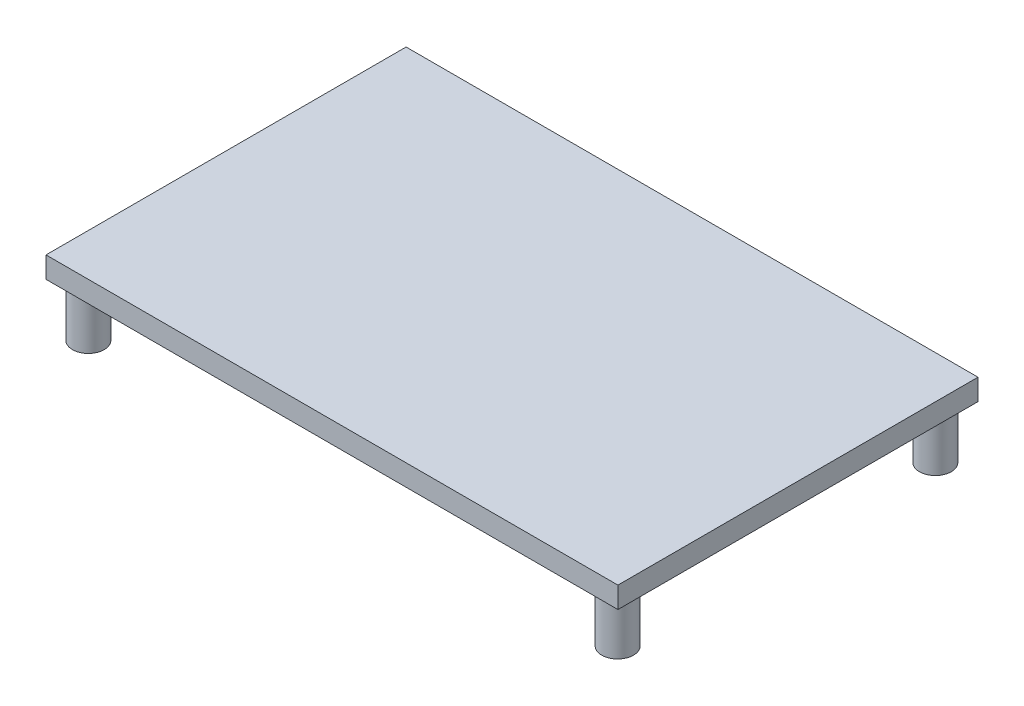
from build123d import *

# Parameters (mm, degrees)
SKETCH1_W                          = 54
SKETCH1_H                          = 34
BOSS_EXTRUDE1_DEPTH                = 2
SKETCH4_R                          = 1.5
BOSS_EXTRUDE2_DEPTH                = 5
M1_2X0_25_TAPPED_HOLE1_D           = 0.95
M1_2X0_25_TAPPED_HOLE1_DEPTH       = 5
M1_2X0_25_TAPPED_HOLE1_CSINK_D     = 1.25
M1_2X0_25_TAPPED_HOLE1_CSINK_ANGLE = 90
M1_2X0_25_TAPPED_HOLE1_TIP         = 0.285408794


with BuildPart() as part:
    # Sketch1 → Boss-Extrude1 (new body)
    with BuildSketch(Plane(origin=(0, 0, 0), x_dir=(1, 0, 0), z_dir=(0, 1, 0))):
        with Locations((-15.073860766, 22.005565176)):
            Rectangle(SKETCH1_W, SKETCH1_H)
    extrude(amount=BOSS_EXTRUDE1_DEPTH)

    # Sketch4 → Boss-Extrude2 (add)
    with BuildSketch(Plane.XZ):
        with Locations(Location((-40.073860766, -7.005565176, 0), (0, 0, 90))):
            Circle(SKETCH4_R)
        with Locations(Location((9.897863343, -7.006700775, 0), (0, 0, 90))):
            Circle(SKETCH4_R)
        with Locations(Location((9.897863343, -37.006700775, 0), (0, 0, 90))):
            Circle(SKETCH4_R)
        with Locations(Location((-40.073860766, -37.005565176, 0), (0, 0, 90))):
            Circle(SKETCH4_R)
    extrude(amount=BOSS_EXTRUDE2_DEPTH)

    # M1.2x0.25 Tapped Hole1
    with Locations(Plane(origin=(-40.073860766, -5, -7.005565176), x_dir=(0, 0, -1), z_dir=(0, -1, 0))):
        with Locations((0, 0), (30, 0), (0.001135599, 49.971724109), (30.001135599, 49.971724109)):
            CounterSinkHole(M1_2X0_25_TAPPED_HOLE1_D / 2, M1_2X0_25_TAPPED_HOLE1_CSINK_D / 2, depth=M1_2X0_25_TAPPED_HOLE1_DEPTH, counter_sink_angle=M1_2X0_25_TAPPED_HOLE1_CSINK_ANGLE)
            with Locations((0, 0, -(M1_2X0_25_TAPPED_HOLE1_DEPTH + M1_2X0_25_TAPPED_HOLE1_TIP / 2))):  # 118° drill point
                Cone(0, M1_2X0_25_TAPPED_HOLE1_D / 2, M1_2X0_25_TAPPED_HOLE1_TIP, mode=Mode.SUBTRACT)


solid = part.part
